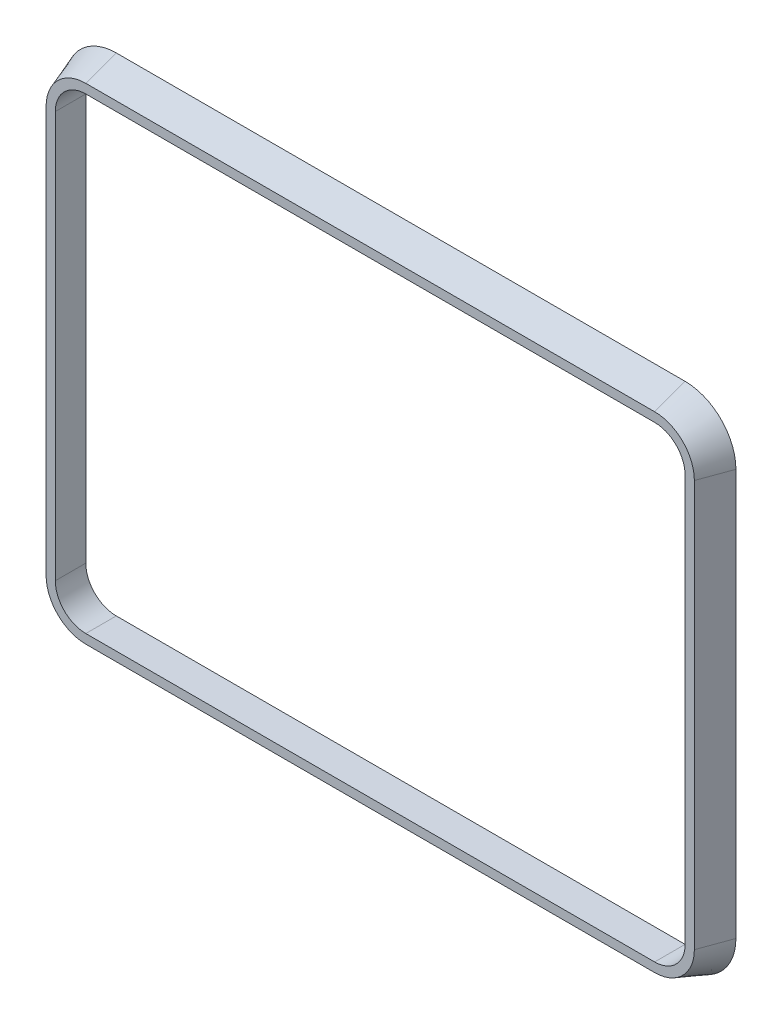
from build123d import *

# Parameters (mm, degrees)
BOSS_EXTRUDE1_DEPTH = 3
BOSS_EXTRUDE1_TAPER = 20
CUT_EXTRUDE1_DEPTH  = 42.509035161


with BuildPart() as part:
    # Sketch1 → Boss-Extrude1 (new body)
    with BuildSketch(Plane.XY):
        with BuildLine():
            Line((-28, -25), (28, -25))
            ThreePointArc((28, -25), (31.535533906, -23.535533906), (33, -20))
            Line((33, -20), (33, 20))
            ThreePointArc((33, 20), (31.535533906, 23.535533906), (28, 25))
            Line((28, 25), (-28, 25))
            ThreePointArc((-28, 25), (-31.535533906, 23.535533906), (-33, 20))
            Line((-33, 20), (-33, -20))
            ThreePointArc((-33, -20), (-31.535533906, -23.535533906), (-28, -25))
        make_face()
    extrude(amount=BOSS_EXTRUDE1_DEPTH, taper=BOSS_EXTRUDE1_TAPER)

    # Sketch2 → Cut-Extrude1 (cut, through all)
    with BuildSketch(Plane.XY.offset(3)):
        with BuildLine():
            Line((-28, -23), (28, -23))
            ThreePointArc((28, -23), (30.121320344, -22.121320344), (31, -20))
            Line((31, -20), (31, 20))
            ThreePointArc((31, 20), (30.121320344, 22.121320344), (28, 23))
            Line((28, 23), (-28, 23))
            ThreePointArc((-28, 23), (-30.121320344, 22.121320344), (-31, 20))
            Line((-31, 20), (-31, -20))
            ThreePointArc((-31, -20), (-30.121320344, -22.121320344), (-28, -23))
        make_face()
    extrude(amount=-CUT_EXTRUDE1_DEPTH, mode=Mode.SUBTRACT)


solid = part.part
